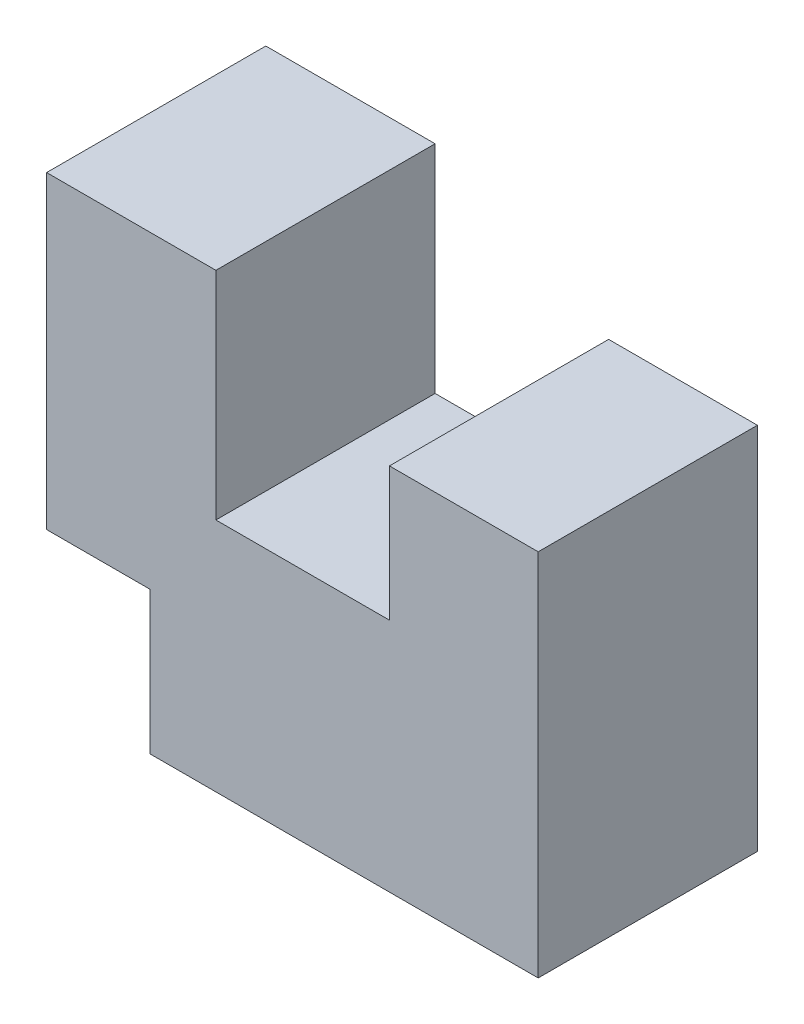
from build123d import *

# Parameters (mm, degrees)
BOSS_EXTRU_1_DEPTH = 40


with BuildPart() as part:
    # Esquisse1 → Boss.-Extru.1 (new body)
    with BuildSketch(Plane.XY):
        Polygon((0, 0), (0, 56.425552969), (30.894916083, 56.425552969), (30.894916083, 16.965366705), (62.5636006, 16.965366705), (62.5636006, 41.345227008), (89.708187329, 41.345227008), (89.708187329, -26.013562282), (18.830655315, -26.013562282), (18.830655315, 0), align=None)
    extrude(amount=BOSS_EXTRU_1_DEPTH)


solid = part.part
